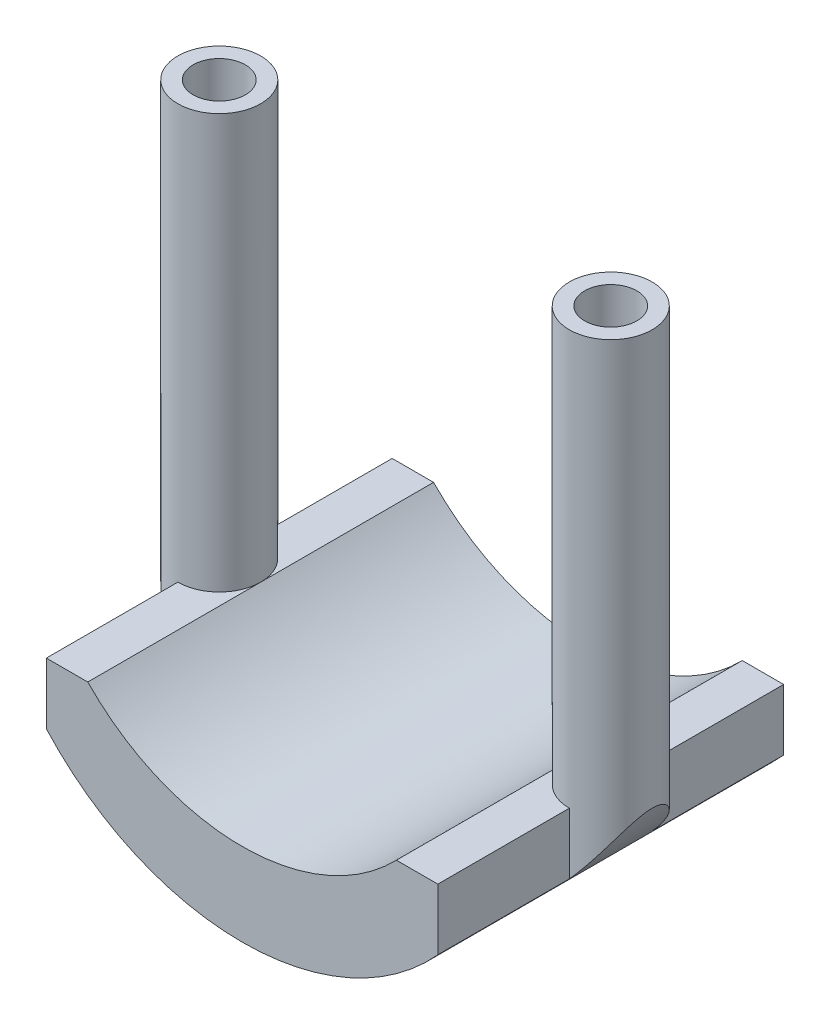
from build123d import *

# Parameters (mm, degrees)
SKETCH1_R             = 3.175
BOSS_EXTRUDE1_DEPTH   = 31.75
BOSS_EXTRUDE1_2_DEPTH = 31.75
BOSS_EXTRUDE2_START   = 20
BOSS_EXTRUDE2_DEPTH   = 20
CUT_EXTRUDE2_DEPTH    = 46.173478115
SKETCH4_R             = 2
CUT_EXTRUDE3_DEPTH    = 3.175


with BuildPart() as part:
    # Sketch1 → Boss-Extrude1 (new body)
    with BuildSketch(Plane(origin=(0, 0, 0), x_dir=(1, 0, 0), z_dir=(0, 1, 0))):
        with Locations(Location((-15, 0, 0), (0, 0, 270))):
            Circle(SKETCH1_R)
    extrude(amount=BOSS_EXTRUDE1_DEPTH)



with BuildPart() as body_2:
    # Sketch1 → Boss-Extrude1 2 (new body)
    with BuildSketch(Plane(origin=(0, 0, 0), x_dir=(1, 0, 0), z_dir=(0, 1, 0))):
        with Locations(Location((15, 0, 0), (0, 0, 270))):
            Circle(SKETCH1_R)
    extrude(amount=BOSS_EXTRUDE1_2_DEPTH)


with BuildPart() as part_1:
    add(part.part)

    add(body_2.part)  # Boss-Extrude2 merges body 2
    # Sketch2 → Boss-Extrude2 (add)
    with BuildSketch(Plane.XZ.offset(BOSS_EXTRUDE2_START)):
        with BuildLine():
            Line((-15, 3.175), (-15, 13.25))
            Line((-15, 13.25), (15, 13.25))
            Line((15, 13.25), (15, 3.175))
            ThreePointArc((15, 3.175), (18.175, 0), (15, -3.175))
            Line((15, -3.175), (15, -13.25))
            Line((15, -13.25), (-15, -13.25))
            Line((-15, -13.25), (-15, -3.175))
            ThreePointArc((-15, -3.175), (-18.175, 0), (-15, 3.175))
        make_face()
    extrude(amount=-BOSS_EXTRUDE2_DEPTH)

    # Sketch5 → Cut-Extrude2 (cut, through all)
    with BuildSketch(Plane.XY.offset(13.25)):
        with BuildLine():
            ThreePointArc((15, -4.692512186), (0, -11.35), (-15, -4.692512186))
            Line((-15, -4.692512186), (-15, -20))
            Line((-15, -20), (15, -20))
            Line((15, -20), (15, -4.692512186))
        make_face()
        with BuildLine():
            ThreePointArc((-15, -4.692512186), (-16.752613942, -2.457973814), (-18.175, 0))
            Line((-18.175, 0), (-18.175, -20))
            Line((-18.175, -20), (-15, -20))
            Line((-15, -20), (-15, -4.692512186))
        make_face()
        with BuildLine():
            ThreePointArc((18.175, 0), (16.752613942, -2.457973814), (15, -4.692512186))
            Line((15, -4.692512186), (15, -20))
            Line((15, -20), (18.175, -20))
            Line((18.175, -20), (18.175, 0))
        make_face()
        with BuildLine():
            ThreePointArc((-11.825, 0), (0, -5), (11.825, 0))
            Line((11.825, 0), (-11.825, 0))
        make_face()
    extrude(amount=-CUT_EXTRUDE2_DEPTH, mode=Mode.SUBTRACT)

    # Sketch4 → Cut-Extrude3 (cut)
    with BuildSketch(Plane(origin=(0, 31.75, 0), x_dir=(1, 0, 0), z_dir=(0, 1, 0))):
        with Locations(Location((-15, 0, 0), (0, 0, 270))):
            Circle(SKETCH4_R)
        with Locations(Location((15, 0, 0), (0, 0, 270))):
            Circle(SKETCH4_R)
    extrude(amount=-CUT_EXTRUDE3_DEPTH, mode=Mode.SUBTRACT)


solid = part_1.part
